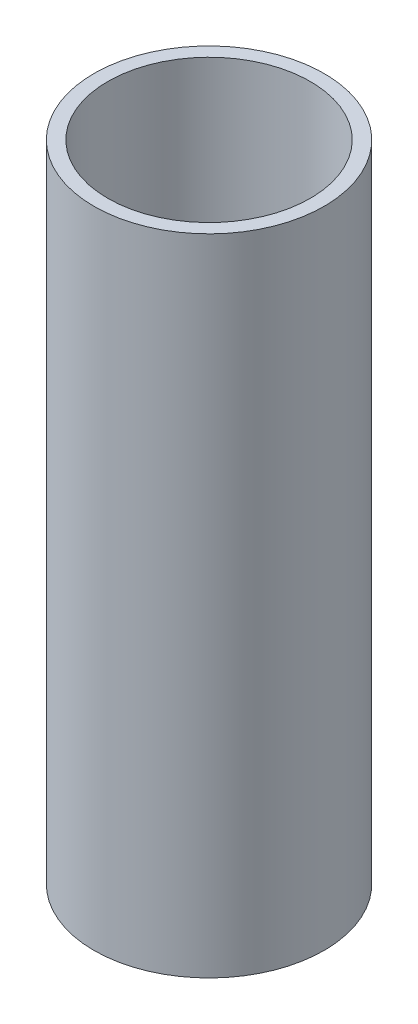
from build123d import *

# Parameters (mm, degrees)
SKETCH_1_R      = 25
SKETCH_1_R_2    = 22
EXTRUDE_1_DEPTH = 140


with BuildPart() as part:
    # 스케치1 → 보스-돌출1 (new body)
    with BuildSketch(Plane(origin=(0, 0, 0), x_dir=(1, 0, 0), z_dir=(0, 1, 0))):
        with Locations(Location((0, 0, 0), (0, 0, 270))):
            Circle(SKETCH_1_R)
        with Locations(Location((0, 0, 0), (0, 0, 270))):
            Circle(SKETCH_1_R_2, mode=Mode.SUBTRACT)
    extrude(amount=EXTRUDE_1_DEPTH)


solid = part.part
